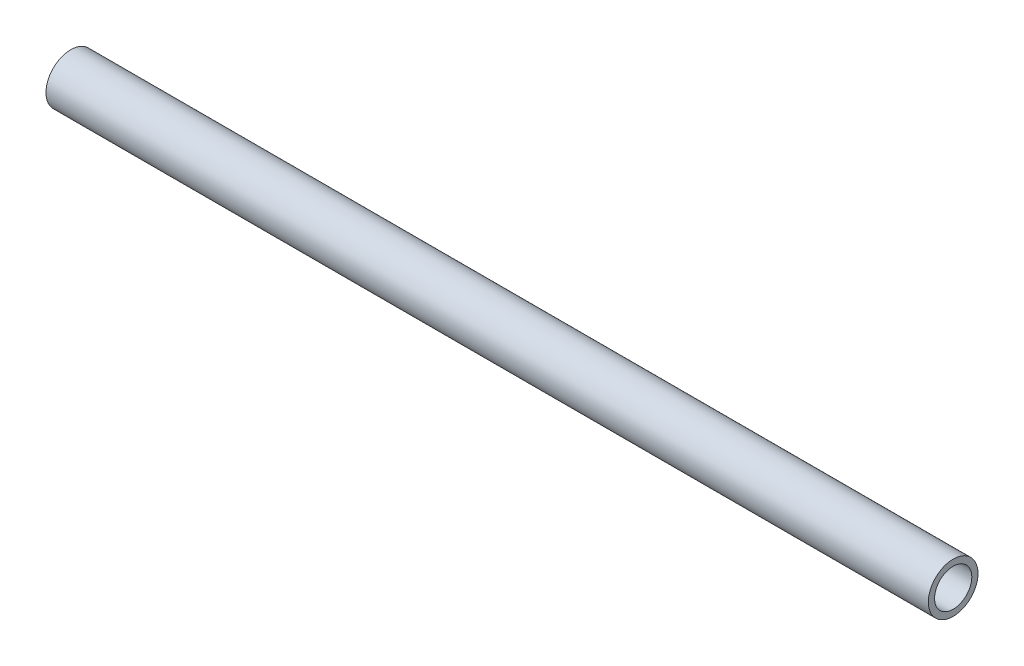
from build123d import *

# Parameters (mm, degrees)
SKETCH2_R           = 0.5
SKETCH2_R_2         = 0.375
BOSS_EXTRUDE1_DEPTH = 17.77


with BuildPart() as part:
    # Sketch2 → Boss-Extrude1 (new body)
    with BuildSketch(Plane(origin=(0, 0, 0), x_dir=(0, 0, -1), z_dir=(1, 0, 0))):
        Circle(SKETCH2_R)
        Circle(SKETCH2_R_2, mode=Mode.SUBTRACT)
    extrude(amount=BOSS_EXTRUDE1_DEPTH)


solid = part.part
